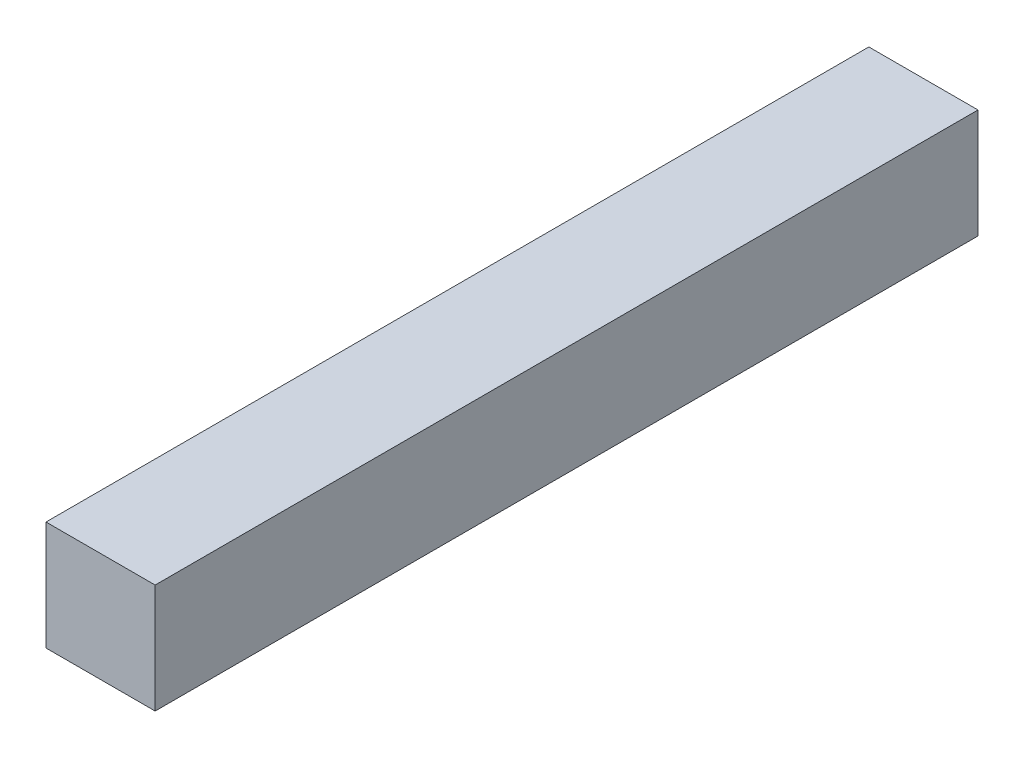
from build123d import *

# Parameters (mm, degrees)
SKETCH1_W           = 13
SKETCH1_H           = 13
BOSS_EXTRUDE1_DEPTH = 98


with BuildPart() as part:
    # Sketch1 → Boss-Extrude1 (new body)
    with BuildSketch(Plane.XY):
        with Locations((6.5, 6.5)):
            Rectangle(SKETCH1_W, SKETCH1_H)
    extrude(amount=-BOSS_EXTRUDE1_DEPTH)


solid = part.part
